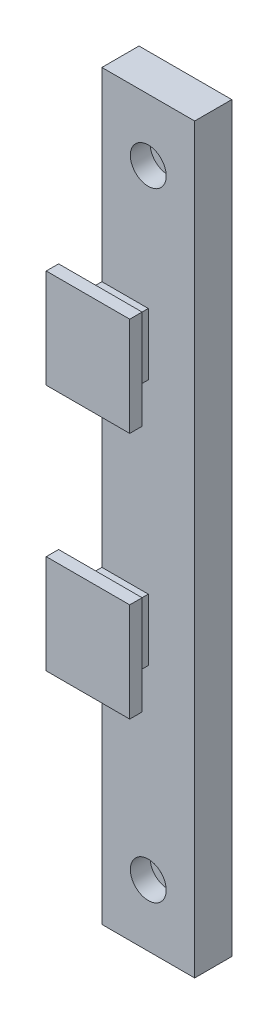
from build123d import *

# Parameters (mm, degrees)
SKETCH_1_W          = 15
SKETCH_1_H          = 120
EXTRUDE_1_DEPTH     = 6
SKETCH_2_R          = 1.65
CUT_EXTRUDE_1_DEPTH = 61.763887302
SKETCH_3_W          = 5.8
SKETCH_3_H          = 15.8
CUT_EXTRUDE_2_DEPTH = 3.1
CUT_EXTRUDE_3_DEPTH = 3.1
SKETCH_5_R          = 2.9
CUT_EXTRUDE_4_DEPTH = 3.2
SKETCH_6_W          = 7.5
SKETCH_6_H          = 10
EXTRUDE_2_DEPTH     = 4
SKETCH_7_W          = 13.5
SKETCH_7_H          = 16
EXTRUDE_3_DEPTH     = 2


with BuildPart() as part:
    # 草图1 → 凸台-拉伸1 (new body)
    with BuildSketch(Plane.XY):
        Rectangle(SKETCH_1_W, SKETCH_1_H)
    extrude(amount=EXTRUDE_1_DEPTH)

    # 草图2 → 切除-拉伸1 (cut, through all)
    with BuildSketch(Plane.XY.offset(6)):
        with Locations((0, 50)):
            Circle(SKETCH_2_R)
        with Locations(Location((0, -50, 0), (0, 0, 180))):
            Circle(SKETCH_2_R)
    extrude(amount=-CUT_EXTRUDE_1_DEPTH, mode=Mode.SUBTRACT)

    # 草图3 → 切除-拉伸2 (cut)
    with BuildSketch(Plane(origin=(0, 0, 0), x_dir=(-1, 0, 0), z_dir=(0, 0, -1))):
        with Locations((0, -5.44)):
            Rectangle(SKETCH_3_W, SKETCH_3_H)
    extrude(amount=-CUT_EXTRUDE_2_DEPTH, mode=Mode.SUBTRACT)

    # 草图4 → 切除-拉伸3 (cut)
    with BuildSketch(Plane(origin=(0, 0, 0), x_dir=(-1, 0, 0), z_dir=(0, 0, -1))):
        Polygon((-2.9, 2.46), (0, 5.36), (2.9, 2.46), align=None)
    extrude(amount=-CUT_EXTRUDE_3_DEPTH, mode=Mode.SUBTRACT)

    # 草图5 → 切除-拉伸4 (cut)
    with BuildSketch(Plane.XY.offset(6)):
        with Locations((0, 50)):
            Circle(SKETCH_5_R)
        with Locations((0, -50)):
            Circle(SKETCH_5_R)
    extrude(amount=-CUT_EXTRUDE_4_DEPTH, mode=Mode.SUBTRACT)

    # 草图6 → 凸台-拉伸2 (add)
    with BuildSketch(Plane.XY.offset(6)):
        with Locations((-3.75, -15)):
            Rectangle(SKETCH_6_W, SKETCH_6_H)
        with Locations((-3.75, 25)):
            Rectangle(SKETCH_6_W, SKETCH_6_H)
    extrude(amount=EXTRUDE_2_DEPTH)

    # 草图7 → 凸台-拉伸3 (add)
    with BuildSketch(Plane.XY.offset(10)):
        with Locations((-3.75, 25)):
            Rectangle(SKETCH_7_W, SKETCH_7_H)
        with Locations((-3.75, -15)):
            Rectangle(SKETCH_7_W, SKETCH_7_H)
    extrude(amount=EXTRUDE_3_DEPTH)


solid = part.part
